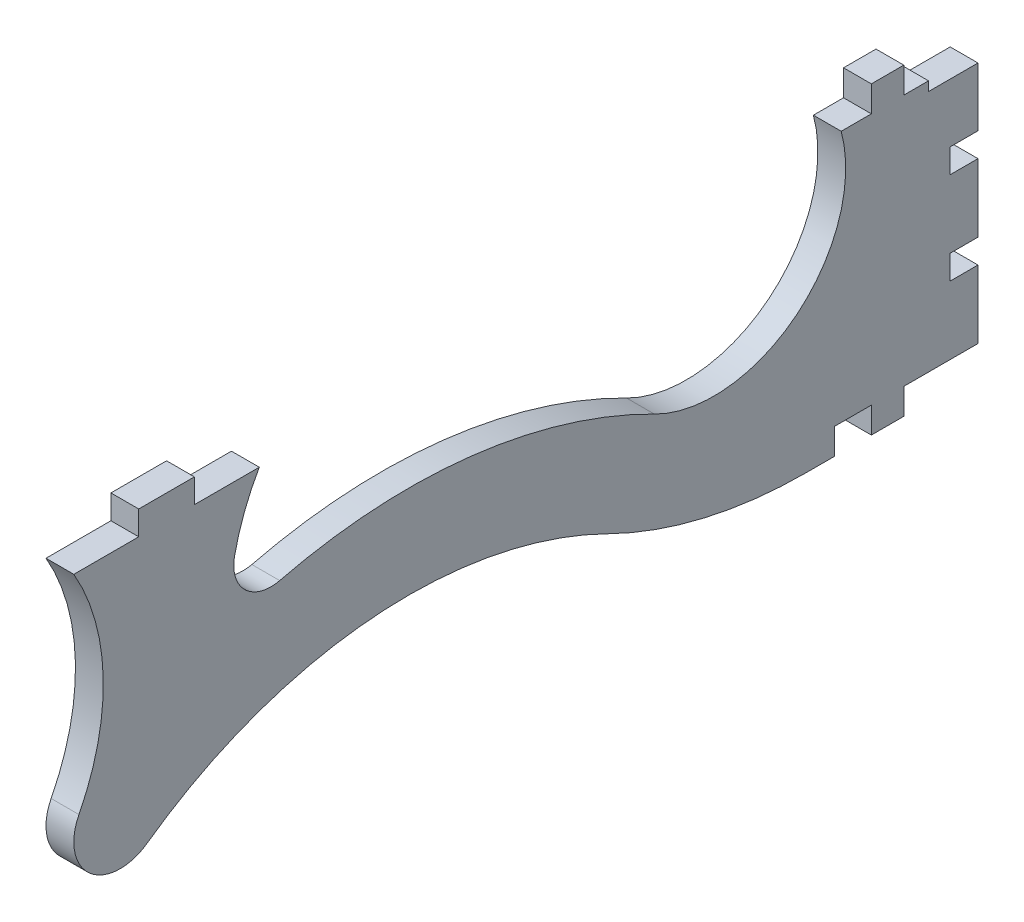
from build123d import *

# Parameters (mm, degrees)
BOSS_EXTRUDE1_DEPTH      = 1.5
BOSS_EXTRUDE1_DEPTH_BACK = 1.5
CUT_EXTRUDE1_DEPTH       = 106.28456677


with BuildPart() as part:
    # Sketch1 → Boss-Extrude1 (new, two sides: drawn at the far end of the back side and taken through both)
    with BuildSketch(Plane(origin=(0, 0, 0), x_dir=(0, 0, -1), z_dir=(1, 0, 0)).offset(-BOSS_EXTRUDE1_DEPTH_BACK)):
        with BuildLine():
            Line((-80, 30), (-87, 30))
            Line((-87, 30), (-87, 32.6))
            Line((-87, 32.6), (-93, 32.6))
            Line((-93, 32.6), (-93, 30))
            Line((-93, 30), (-100, 30))
            ThreePointArc((-100, 30), (-96.828033965, 18.713629613), (-99.446714265, 7.28620477))
            ThreePointArc((-99.446714265, 7.28620477), (-98.266775294, 1.214741861), (-92.088027506, 0.935468515))
            ThreePointArc((-92.088027506, 0.935468515), (-67.824329395, 9.838481267), (-42.435753596, 5))
            ThreePointArc((-42.435753596, 5), (-32.005584176, 1.266555107), (-21, 0))
            Line((-21, 0), (-18, 0))
            Line((-18, 0), (-18, 2.8))
            Line((-18, 2.8), (-14, 2.8))
            Line((-14, 2.8), (-14, 0))
            Line((-14, 0), (-10.5, 0))
            Line((-10.5, 0), (-10.5, 2.8))
            Line((-10.5, 2.8), (-2.5, 2.8))
            Line((-2.5, 2.8), (-2.5, 10.133333333))
            Line((-2.5, 10.133333333), (-5.5, 10.133333333))
            Line((-5.5, 10.133333333), (-5.5, 12.733333333))
            Line((-5.5, 12.733333333), (-2.5, 12.733333333))
            Line((-2.5, 12.733333333), (-2.5, 20.066666667))
            Line((-2.5, 20.066666667), (-5.5, 20.066666667))
            Line((-5.5, 20.066666667), (-5.5, 22.666666667))
            Line((-5.5, 22.666666667), (-2.5, 22.666666667))
            Line((-2.5, 22.666666667), (-2.5, 30))
            Line((-2.5, 30), (-10.5, 30))
            Line((-10.5, 30), (-10.5, 32.8))
            Line((-10.5, 32.8), (-14, 32.8))
            Line((-14, 32.8), (-14, 30))
            Line((-14, 30), (-17.249742261, 30))
            ThreePointArc((-17.249742261, 30), (-22.023510763, 15.292477496), (-37.40016873, 13.661994841))
            ThreePointArc((-37.40016873, 13.661994841), (-57.183488606, 19.61610248), (-77.802405966, 18.315567968))
            ThreePointArc((-77.802405966, 18.315567968), (-81.536934186, 19.325375212), (-82.669963788, 23.024382595))
            ThreePointArc((-82.669963788, 23.024382595), (-81.611172702, 26.61790516), (-80, 30))
        make_face()
    extrude(amount=BOSS_EXTRUDE1_DEPTH + BOSS_EXTRUDE1_DEPTH_BACK)

    # Sketch2 → Cut-Extrude1 (cut, through all)
    with BuildSketch(Plane(origin=(1.5, 0, 0), x_dir=(0, 0, -1), z_dir=(1, 0, 0))):
        Polygon((-7.833333333, 30), (-5.166666667, 30), (-2.5, 30), (-2.5, 29), (-7.833333333, 29), align=None)
    extrude(amount=-CUT_EXTRUDE1_DEPTH, mode=Mode.SUBTRACT)


solid = part.part
